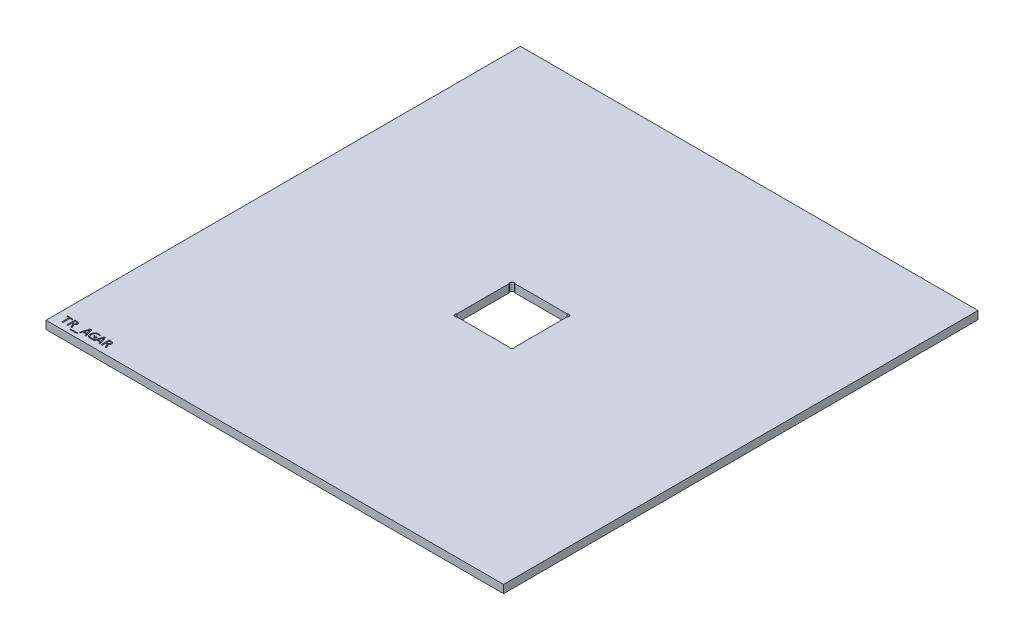
from build123d import *

# Parameters (mm, degrees)
SKETCH1_W           = 180.848
SKETCH1_H           = 187.5155
BOSS_EXTRUDE1_DEPTH = 3.175
SKETCH2_W           = 22.86
SKETCH2_H           = 22.86
CUT_EXTRUDE1_DEPTH  = 3.175
SKETCH3_R           = 0.79375
CUT_EXTRUDE2_DEPTH  = 131.296186
SKETCH4_W           = 2.714855072
SKETCH4_H           = 0.368115942
CUT_EXTRUDE3_DEPTH  = 1.5875


with BuildPart() as part:
    # Sketch1 → Boss-Extrude1 (new body)
    with BuildSketch(Plane(origin=(0, 0, 0), x_dir=(1, 0, 0), z_dir=(0, 1, 0))):
        Rectangle(SKETCH1_W, SKETCH1_H)
    extrude(amount=BOSS_EXTRUDE1_DEPTH)

    # Sketch2 → Cut-Extrude1 (cut)
    with BuildSketch(Plane(origin=(0, 3.175, 0), x_dir=(1, 0, 0), z_dir=(0, 1, 0))):
        Rectangle(SKETCH2_W, SKETCH2_H)
    extrude(amount=-CUT_EXTRUDE1_DEPTH, mode=Mode.SUBTRACT)

    # Sketch3 → Cut-Extrude2 (cut, through all)
    with BuildSketch(Plane(origin=(0, 3.175, 0), x_dir=(1, 0, 0), z_dir=(0, 1, 0))):
        with Locations((-10.868733992, 10.868733992)):
            Circle(SKETCH3_R)
        with Locations((10.868733992, 10.868733992)):
            Circle(SKETCH3_R)
        with Locations((10.868733992, -10.868733992)):
            Circle(SKETCH3_R)
        with Locations((-10.868733992, -10.868733992)):
            Circle(SKETCH3_R)
    extrude(amount=-CUT_EXTRUDE2_DEPTH, mode=Mode.SUBTRACT)

    # Sketch4 → Cut-Extrude3 (cut)
    # profile 1 of 7: a face of its own
    with BuildSketch(Plane(origin=(0, 3.175, 0), x_dir=(1, 0, 0), z_dir=(0, 1, 0))):
        Polygon((-85.353202899, -88.410865942), (-86.273492754, -88.410865942), (-86.273492754, -91.21775), (-86.733637681, -91.21775), (-86.733637681, -88.410865942), (-87.653927536, -88.410865942), (-87.653927536, -88.04275), (-85.353202899, -88.04275), align=None)
    # profile 2 of 7: a face of its own
    with BuildSketch(Plane(origin=(0, 3.175, 0), x_dir=(1, 0, 0), z_dir=(0, 1, 0))):
        with BuildLine():
            Line((-82.638347826, -91.21775), (-83.125813859, -91.21775))
            Line((-83.125813859, -91.21775), (-83.582363904, -90.226281476))
            add(Edge.make_bspline(
                [(-83.582363904, -90.226281476), (-83.598860974, -90.191130284), (-83.629465089, -90.125920458), (-83.683350175, -90.040294449), (-83.73916016, -89.971305876), (-83.799615044, -89.918268069), (-83.865569382, -89.879574558), (-83.937441008, -89.854540538), (-84.016272547, -89.839988328), (-84.071201483, -89.838235213), (-84.100026947, -89.837315217)],
                knots=[0, 0, 0, 0, 1.339134837, 2.484261414, 3.482991323, 4.391871607, 5.244507385, 6.105289549, 7.005698766, 8, 8, 8, 8], degree=3))
            Line((-84.100026947, -89.837315217), (-84.294869565, -89.837315217))
            Line((-84.294869565, -89.837315217), (-84.294869565, -91.21775))
            Line((-84.294869565, -91.21775), (-84.755014493, -91.21775))
            Line((-84.755014493, -91.21775), (-84.755014493, -88.04275))
            Line((-84.755014493, -88.04275), (-83.910936141, -88.04275))
            add(Edge.make_bspline(
                [(-83.910936141, -88.04275), (-83.866571096, -88.043324801), (-83.781034279, -88.044433032), (-83.657527264, -88.056115686), (-83.543677978, -88.074962175), (-83.439661951, -88.102534986), (-83.344774287, -88.136226928), (-83.258689811, -88.176489474), (-83.181396775, -88.223089264), (-83.113190469, -88.276260019), (-83.052893824, -88.334285294), (-83.002293397, -88.399280748), (-82.959385051, -88.469287391), (-82.925710385, -88.545372647), (-82.900177177, -88.626034235), (-82.88111807, -88.710889782), (-82.870477515, -88.800037309), (-82.869113537, -88.860918232), (-82.86842029, -88.891861187)],
                knots=[0, 0, 0, 0, 1.390037284, 2.680023546, 3.883960013, 5.002565466, 6.047913656, 7.03574216, 7.976084698, 8.870016629, 9.741095147, 10.591561451, 11.444313202, 12.308368875, 13.191986167, 14.092206828, 15.030357037, 16, 16, 16, 16], degree=3))
            add(Edge.make_bspline(
                [(-82.86842029, -88.891861187), (-82.868994868, -88.916809205), (-82.870124847, -88.965872567), (-82.878430329, -89.038414802), (-82.89100624, -89.108963136), (-82.909849703, -89.177190844), (-82.933612198, -89.242831971), (-82.962310371, -89.305834559), (-82.997136135, -89.36550299), (-83.036557213, -89.422458811), (-83.081411438, -89.475782218), (-83.130948802, -89.525652899), (-83.18635394, -89.570899919), (-83.245486917, -89.613413484), (-83.309965112, -89.651029424), (-83.379136935, -89.683170015), (-83.452650391, -89.710818718), (-83.503864807, -89.724616993), (-83.529878623, -89.731625679)],
                knots=[0, 0, 0, 0, 1.032708305, 2.030948508, 3.019625047, 3.996933367, 4.957424013, 5.907556856, 6.85893238, 7.814077788, 8.77200233, 9.740252168, 10.719774328, 11.730219428, 12.753012585, 13.805036997, 14.885091985, 16, 16, 16, 16], degree=3))
            add(Edge.make_bspline(
                [(-83.529878623, -89.731625679), (-83.508734767, -89.739380778), (-83.466783942, -89.754767413), (-83.409104807, -89.789031767), (-83.354855427, -89.828859176), (-83.307413111, -89.879758478), (-83.261027139, -89.937088784), (-83.215047309, -90.003148469), (-83.168355492, -90.077696238), (-83.138952467, -90.131452504), (-83.123656929, -90.159416667)],
                knots=[0, 0, 0, 0, 0.890820497, 1.767447404, 2.649001527, 3.549193506, 4.515009134, 5.571837998, 6.736863216, 8, 8, 8, 8], degree=3))
            Line((-83.123656929, -90.159416667), (-82.638347826, -91.21775))
        make_face()
        with BuildLine():
            add(Edge.make_bspline(
                [(-83.328565217, -88.922777174), (-83.328901843, -88.901906114), (-83.32955407, -88.861467484), (-83.336773162, -88.802931226), (-83.34912625, -88.74858325), (-83.365581675, -88.698221992), (-83.386140981, -88.651372969), (-83.413407518, -88.609650848), (-83.444183923, -88.571263632), (-83.479733549, -88.537216471), (-83.519769509, -88.507597987), (-83.563758214, -88.481855754), (-83.611291845, -88.459414038), (-83.662835579, -88.441302724), (-83.718322956, -88.428061778), (-83.777599298, -88.41773837), (-83.840852671, -88.41224996), (-83.884324813, -88.411335157), (-83.906622283, -88.410865942)],
                knots=[0, 0, 0, 0, 1.136086502, 2.201219443, 3.204852043, 4.166451082, 5.083443327, 5.98129036, 6.87199526, 7.758098985, 8.653381414, 9.577773354, 10.529401831, 11.511765708, 12.546811162, 13.632454437, 14.78565276, 16, 16, 16, 16], degree=3))
            Line((-83.906622283, -88.410865942), (-84.294869565, -88.410865942))
            Line((-84.294869565, -88.410865942), (-84.294869565, -89.469199275))
            Line((-84.294869565, -89.469199275), (-83.961983469, -89.469199275))
            add(Edge.make_bspline(
                [(-83.961983469, -89.469199275), (-83.93824743, -89.468775061), (-83.891881464, -89.467946402), (-83.824245057, -89.461800526), (-83.760525642, -89.449675605), (-83.700090994, -89.435336816), (-83.643820366, -89.415000628), (-83.592001738, -89.390397511), (-83.543763099, -89.362541635), (-83.500833591, -89.329095915), (-83.461473321, -89.292318472), (-83.427024794, -89.251260372), (-83.397057325, -89.206291797), (-83.372862702, -89.156799379), (-83.3522013, -89.103890377), (-83.339197548, -89.046440031), (-83.330033673, -88.985862033), (-83.329062587, -88.944144192), (-83.328565217, -88.922777174)],
                knots=[0, 0, 0, 0, 1.202615583, 2.349188572, 3.435207305, 4.486530095, 5.492783739, 6.45958443, 7.390413995, 8.308405015, 9.210274755, 10.115082188, 11.017605575, 11.940721498, 12.901403136, 13.887978084, 14.918265918, 16, 16, 16, 16], degree=3))
        make_face(mode=Mode.SUBTRACT)
    # profile 3 of 7: a face of its own
    with BuildSketch(Plane(origin=(0, 3.175, 0), x_dir=(1, 0, 0), z_dir=(0, 1, 0))):
        with Locations((-81.096862319, -92.04601087)):
            Rectangle(SKETCH4_W, SKETCH4_H)
    # profile 4 of 7: a face of its own
    with BuildSketch(Plane(origin=(0, 3.175, 0), x_dir=(1, 0, 0), z_dir=(0, 1, 0))):
        Polygon((-77.047586957, -91.21775), (-77.518516531, -91.21775), (-77.73133356, -90.527532609), (-79.049936368, -90.527532609), (-79.267786232, -91.21775), (-79.716427536, -91.21775), (-78.660970109, -88.04275), (-78.069252491, -88.04275), align=None)
        Polygon((-77.844212862, -90.159416667), (-78.382007246, -88.413022871), (-78.933462183, -90.159416667), align=None, mode=Mode.SUBTRACT)
    # profile 5 of 7: a face of its own
    with BuildSketch(Plane(origin=(0, 3.175, 0), x_dir=(1, 0, 0), z_dir=(0, 1, 0))):
        with BuildLine():
            add(Edge.make_bspline(
                [(-74.539797101, -88.54890942), (-74.60088242, -88.521740636), (-74.722687635, -88.467565594), (-74.882749187, -88.418941509), (-75.014461313, -88.390859585), (-75.117737644, -88.37597488), (-75.225273679, -88.36625466), (-75.298535188, -88.365323744), (-75.335704031, -88.364851449)],
                knots=[0, 0, 0, 0, 1.45945927, 2.910187841, 3.643322816, 4.400006487, 5.188251666, 6, 6, 6, 6], degree=3))
            add(Edge.make_bspline(
                [(-75.335704031, -88.364851449), (-75.377952623, -88.365871448), (-75.460422107, -88.36786249), (-75.580300394, -88.385836913), (-75.693484568, -88.413157997), (-75.79861516, -88.453935969), (-75.896218664, -88.504396253), (-75.986280949, -88.564570448), (-76.06827998, -88.634341651), (-76.141963051, -88.71347597), (-76.208125391, -88.800845871), (-76.26429672, -88.898016011), (-76.314592741, -89.002484312), (-76.354950388, -89.115638858), (-76.387815137, -89.235707374), (-76.408945322, -89.362714528), (-76.424547206, -89.495416613), (-76.425767986, -89.586103268), (-76.426391304, -89.632406929)],
                knots=[0, 0, 0, 0, 1.073569988, 2.0956145, 3.075462191, 4.028316933, 4.954955511, 5.864200373, 6.776299374, 7.685952519, 8.608514939, 9.556388192, 10.53488969, 11.552674678, 12.606592505, 13.695564134, 14.823379042, 16, 16, 16, 16], degree=3))
            add(Edge.make_bspline(
                [(-76.426391304, -89.632406929), (-76.42572496, -89.680596615), (-76.424430278, -89.774227416), (-76.413703681, -89.91114442), (-76.394846297, -90.039982668), (-76.37040396, -90.161651652), (-76.336682027, -90.274507607), (-76.294918899, -90.378791407), (-76.245252223, -90.474452233), (-76.187150429, -90.561257979), (-76.119566539, -90.638172906), (-76.043507092, -90.705615013), (-75.958617999, -90.763345554), (-75.865284406, -90.812184268), (-75.762113923, -90.849182444), (-75.650160013, -90.876739217), (-75.528340538, -90.892236158), (-75.444072666, -90.894483935), (-75.400411911, -90.895648551)],
                knots=[0, 0, 0, 0, 1.243148344, 2.415391902, 3.539864978, 4.600895424, 5.61417527, 6.574020235, 7.494941044, 8.390096718, 9.261974012, 10.129213218, 11.00555139, 11.904308457, 12.839297802, 13.826028221, 14.87362472, 16, 16, 16, 16], degree=3))
            add(Edge.make_bspline(
                [(-75.400411911, -90.895648551), (-75.384348835, -90.895303542), (-75.350990077, -90.894587051), (-75.299674718, -90.890802999), (-75.24663671, -90.8853401), (-75.19325159, -90.877059819), (-75.140608022, -90.868182061), (-75.089927604, -90.856825649), (-75.04315913, -90.843452131), (-75.013796067, -90.832997468), (-74.999942029, -90.828064764)],
                knots=[0, 0, 0, 0, 0.945101657, 1.962726016, 3.026203458, 4.081046807, 5.14040368, 6.166587829, 7.134962126, 8, 8, 8, 8], degree=3))
            Line((-74.999942029, -90.828064764), (-74.999942029, -89.791300725))
            Line((-74.999942029, -89.791300725), (-75.638393116, -89.791300725))
            Line((-75.638393116, -89.791300725), (-75.638393116, -89.423184783))
            Line((-75.638393116, -89.423184783), (-74.539797101, -89.423184783))
            Line((-74.539797101, -89.423184783), (-74.539797101, -91.068921875))
            add(Edge.make_bspline(
                [(-74.539797101, -91.068921875), (-74.574372363, -91.084209916), (-74.644594194, -91.115259696), (-74.754459277, -91.154322393), (-74.868308083, -91.187818769), (-74.984626284, -91.215988811), (-75.102033266, -91.23744728), (-75.218714468, -91.252135487), (-75.332891329, -91.26221614), (-75.408060506, -91.263254422), (-75.444988451, -91.263764493)],
                knots=[0, 0, 0, 0, 0.972427008, 1.974984516, 2.997371287, 4.024859125, 5.052920405, 6.066341974, 7.050062525, 8, 8, 8, 8], degree=3))
            add(Edge.make_bspline(
                [(-75.444988451, -91.263764493), (-75.499216829, -91.262608711), (-75.605160296, -91.260350713), (-75.759802602, -91.240179222), (-75.906332686, -91.20914977), (-76.044460064, -91.164439716), (-76.173176909, -91.107065483), (-76.292647261, -91.037300513), (-76.402195169, -90.955336593), (-76.501431911, -90.860469983), (-76.589434386, -90.752968547), (-76.667893202, -90.633839262), (-76.733248977, -90.501224506), (-76.790134639, -90.357547066), (-76.833575358, -90.2011249), (-76.863941315, -90.032879667), (-76.882979425, -89.853088826), (-76.885326698, -89.729278509), (-76.886536232, -89.665479846)],
                knots=[0, 0, 0, 0, 1.063600106, 2.077906186, 3.054673402, 3.998980003, 4.920963561, 5.814580945, 6.708049843, 7.599412522, 8.501355178, 9.428695674, 10.391875437, 11.396983258, 12.456970005, 13.571147305, 14.748427771, 16, 16, 16, 16], degree=3))
            add(Edge.make_bspline(
                [(-76.886536232, -89.665479846), (-76.885137722, -89.601916062), (-76.882401484, -89.477551062), (-76.861607346, -89.296323705), (-76.826214885, -89.125300286), (-76.777640243, -88.964890651), (-76.715763274, -88.815286728), (-76.64139266, -88.6779203), (-76.557094691, -88.551212376), (-76.460267012, -88.437450198), (-76.352895089, -88.335513598), (-76.234696037, -88.246725272), (-76.107060778, -88.169873995), (-75.968806651, -88.107503688), (-75.822114254, -88.058061513), (-75.667422344, -88.02175672), (-75.505232879, -88.000974016), (-75.394718346, -87.998163284), (-75.338579937, -87.996735507)],
                knots=[0, 0, 0, 0, 1.187604435, 2.323594002, 3.403022287, 4.447090083, 5.450927467, 6.422737292, 7.361747858, 8.289531684, 9.208213513, 10.122694231, 11.046633145, 11.986550994, 12.950975564, 13.935151001, 14.951112262, 16, 16, 16, 16], degree=3))
            add(Edge.make_bspline(
                [(-75.338579937, -87.996735507), (-75.267077594, -87.998024067), (-75.127201251, -88.000544811), (-74.955084181, -88.022839035), (-74.822488328, -88.0474633), (-74.726036963, -88.071369454), (-74.631583895, -88.099842555), (-74.570346797, -88.12315098), (-74.539797101, -88.134778986)],
                knots=[0, 0, 0, 0, 1.577605647, 3.086188538, 3.823906723, 4.553997738, 5.27862473, 6, 6, 6, 6], degree=3))
            Line((-74.539797101, -88.134778986), (-74.539797101, -88.54890942))
        make_face()
    # profile 6 of 7: a face of its own
    with BuildSketch(Plane(origin=(0, 3.175, 0), x_dir=(1, 0, 0), z_dir=(0, 1, 0))):
        Polygon((-71.617876812, -91.21775), (-72.088806386, -91.21775), (-72.301623415, -90.527532609), (-73.620226223, -90.527532609), (-73.838076087, -91.21775), (-74.286717391, -91.21775), (-73.231259964, -88.04275), (-72.639542346, -88.04275), align=None)
        Polygon((-72.414502717, -90.159416667), (-72.952297101, -88.413022871), (-73.503752038, -90.159416667), align=None, mode=Mode.SUBTRACT)
    # profile 7 of 7: a face of its own
    with BuildSketch(Plane(origin=(0, 3.175, 0), x_dir=(1, 0, 0), z_dir=(0, 1, 0))):
        with BuildLine():
            Line((-69.064072464, -91.21775), (-69.551538496, -91.21775))
            Line((-69.551538496, -91.21775), (-70.008088542, -90.226281476))
            add(Edge.make_bspline(
                [(-70.008088542, -90.226281476), (-70.024585612, -90.191130284), (-70.055189726, -90.125920458), (-70.109074813, -90.040294449), (-70.164884797, -89.971305876), (-70.225339681, -89.918268069), (-70.29129402, -89.879574558), (-70.363165646, -89.854540538), (-70.441997185, -89.839988328), (-70.496926121, -89.838235213), (-70.525751585, -89.837315217)],
                knots=[0, 0, 0, 0, 1.339134837, 2.484261414, 3.482991323, 4.391871607, 5.244507385, 6.105289549, 7.005698766, 8, 8, 8, 8], degree=3))
            Line((-70.525751585, -89.837315217), (-70.720594203, -89.837315217))
            Line((-70.720594203, -89.837315217), (-70.720594203, -91.21775))
            Line((-70.720594203, -91.21775), (-71.18073913, -91.21775))
            Line((-71.18073913, -91.21775), (-71.18073913, -88.04275))
            Line((-71.18073913, -88.04275), (-70.336660779, -88.04275))
            add(Edge.make_bspline(
                [(-70.336660779, -88.04275), (-70.292295734, -88.043324801), (-70.206758917, -88.044433032), (-70.083251902, -88.056115686), (-69.969402616, -88.074962175), (-69.865386588, -88.102534986), (-69.770498924, -88.136226928), (-69.684414449, -88.176489474), (-69.607121413, -88.223089264), (-69.538915106, -88.276260019), (-69.478618462, -88.334285294), (-69.428018034, -88.399280748), (-69.385109689, -88.469287391), (-69.351435023, -88.545372647), (-69.325901814, -88.626034235), (-69.306842708, -88.710889782), (-69.296202153, -88.800037309), (-69.294838175, -88.860918232), (-69.294144928, -88.891861187)],
                knots=[0, 0, 0, 0, 1.390037284, 2.680023546, 3.883960013, 5.002565466, 6.047913656, 7.03574216, 7.976084698, 8.870016629, 9.741095147, 10.591561451, 11.444313202, 12.308368875, 13.191986167, 14.092206828, 15.030357037, 16, 16, 16, 16], degree=3))
            add(Edge.make_bspline(
                [(-69.294144928, -88.891861187), (-69.294719506, -88.916809205), (-69.295849485, -88.965872567), (-69.304154967, -89.038414802), (-69.316730878, -89.108963136), (-69.33557434, -89.177190844), (-69.359336835, -89.242831971), (-69.388035009, -89.305834559), (-69.422860773, -89.36550299), (-69.462281851, -89.422458811), (-69.507136076, -89.475782218), (-69.55667344, -89.525652899), (-69.612078578, -89.570899919), (-69.671211555, -89.613413484), (-69.735689749, -89.651029424), (-69.804861573, -89.683170015), (-69.878375029, -89.710818718), (-69.929589445, -89.724616993), (-69.955603261, -89.731625679)],
                knots=[0, 0, 0, 0, 1.032708305, 2.030948508, 3.019625047, 3.996933367, 4.957424013, 5.907556856, 6.85893238, 7.814077788, 8.77200233, 9.740252168, 10.719774328, 11.730219428, 12.753012585, 13.805036997, 14.885091985, 16, 16, 16, 16], degree=3))
            add(Edge.make_bspline(
                [(-69.955603261, -89.731625679), (-69.934459404, -89.739380778), (-69.89250858, -89.754767413), (-69.834829444, -89.789031767), (-69.780580065, -89.828859176), (-69.733137749, -89.879758478), (-69.686751777, -89.937088784), (-69.640771947, -90.003148469), (-69.594080129, -90.077696238), (-69.564677104, -90.131452504), (-69.549381567, -90.159416667)],
                knots=[0, 0, 0, 0, 0.890820497, 1.767447404, 2.649001527, 3.549193506, 4.515009134, 5.571837998, 6.736863216, 8, 8, 8, 8], degree=3))
            Line((-69.549381567, -90.159416667), (-69.064072464, -91.21775))
        make_face()
        with BuildLine():
            add(Edge.make_bspline(
                [(-69.754289855, -88.922777174), (-69.754626481, -88.901906114), (-69.755278708, -88.861467484), (-69.7624978, -88.802931226), (-69.774850888, -88.74858325), (-69.791306313, -88.698221992), (-69.811865619, -88.651372969), (-69.839132155, -88.609650848), (-69.86990856, -88.571263632), (-69.905458187, -88.537216471), (-69.945494147, -88.507597987), (-69.989482852, -88.481855754), (-70.037016483, -88.459414038), (-70.088560217, -88.441302724), (-70.144047594, -88.428061778), (-70.203323936, -88.41773837), (-70.266577308, -88.41224996), (-70.31004945, -88.411335157), (-70.33234692, -88.410865942)],
                knots=[0, 0, 0, 0, 1.136086502, 2.201219443, 3.204852043, 4.166451082, 5.083443327, 5.98129036, 6.87199526, 7.758098985, 8.653381414, 9.577773354, 10.529401831, 11.511765708, 12.546811162, 13.632454437, 14.78565276, 16, 16, 16, 16], degree=3))
            Line((-70.33234692, -88.410865942), (-70.720594203, -88.410865942))
            Line((-70.720594203, -88.410865942), (-70.720594203, -89.469199275))
            Line((-70.720594203, -89.469199275), (-70.387708107, -89.469199275))
            add(Edge.make_bspline(
                [(-70.387708107, -89.469199275), (-70.363972067, -89.468775061), (-70.317606102, -89.467946402), (-70.249969695, -89.461800526), (-70.18625028, -89.449675605), (-70.125815632, -89.435336816), (-70.069545004, -89.415000628), (-70.017726376, -89.390397511), (-69.969487737, -89.362541635), (-69.926558228, -89.329095915), (-69.887197959, -89.292318472), (-69.852749432, -89.251260372), (-69.822781962, -89.206291797), (-69.79858734, -89.156799379), (-69.777925938, -89.103890377), (-69.764922186, -89.046440031), (-69.75575831, -88.985862033), (-69.754787225, -88.944144192), (-69.754289855, -88.922777174)],
                knots=[0, 0, 0, 0, 1.202615583, 2.349188572, 3.435207305, 4.486530095, 5.492783739, 6.45958443, 7.390413995, 8.308405015, 9.210274755, 10.115082188, 11.017605575, 11.940721498, 12.901403136, 13.887978084, 14.918265918, 16, 16, 16, 16], degree=3))
        make_face(mode=Mode.SUBTRACT)
    extrude(amount=-CUT_EXTRUDE3_DEPTH, mode=Mode.SUBTRACT)


solid = part.part
